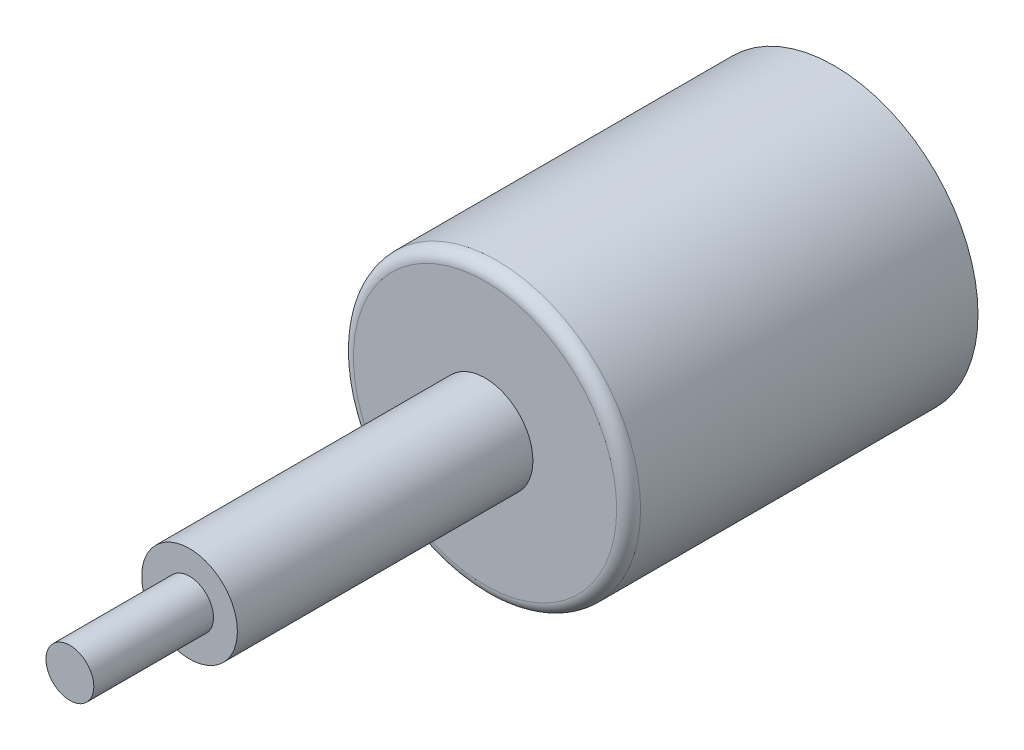
from build123d import *

# Parameters (mm, degrees)
ESQUISSE1_R      = 12
EXTRUSION1_DEPTH = 29.2
CONG_1_R         = 1
ESQUISSE2_R      = 4
EXTRUSION2_DEPTH = 24.7
ESQUISSE3_R      = 2
EXTRUSION3_DEPTH = 10


with BuildPart() as part:
    # Esquisse1 → Extrusion1 (new body)
    with BuildSketch(Plane.XY):
        Circle(ESQUISSE1_R)
    extrude(amount=EXTRUSION1_DEPTH)

    # Congé1
    cong_1_edges = [part.edges().sort_by_distance(p)[0] for p in [
        (-12, 0, 29.2),
    ]]
    fillet(cong_1_edges, radius=CONG_1_R)

    # Esquisse2 → Extrusion2 (add)
    with BuildSketch(Plane.XY.offset(29.2)):
        Circle(ESQUISSE2_R)
    extrude(amount=EXTRUSION2_DEPTH)

    # Esquisse3 → Extrusion3 (add)
    with BuildSketch(Plane.XY.offset(53.9)):
        Circle(ESQUISSE3_R)
    extrude(amount=EXTRUSION3_DEPTH)


solid = part.part
